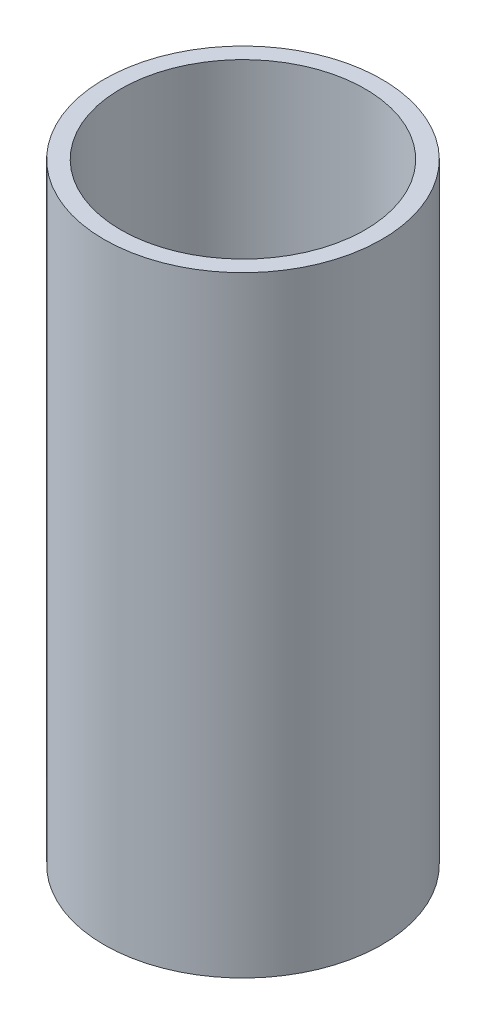
from build123d import *

# Parameters (mm, degrees)
SKETCH1_R           = 12.5
SKETCH1_R_2         = 11
BOSS_EXTRUDE1_DEPTH = 55


with BuildPart() as part:
    # Sketch1 → Boss-Extrude1 (new body)
    with BuildSketch(Plane(origin=(0, 0, 0), x_dir=(1, 0, 0), z_dir=(0, 1, 0))):
        with Locations(Location((0, 0, 0), (0, 0, 270))):
            Circle(SKETCH1_R)
        with Locations(Location((0, 0, 0), (0, 0, 270))):
            Circle(SKETCH1_R_2, mode=Mode.SUBTRACT)
    extrude(amount=BOSS_EXTRUDE1_DEPTH)


solid = part.part
